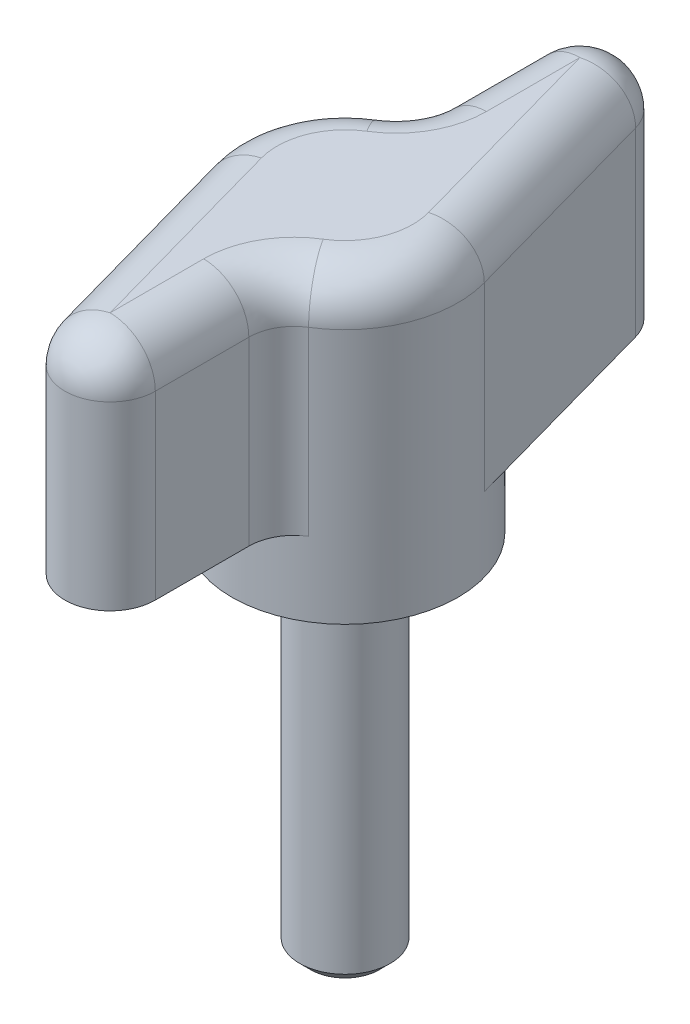
from build123d import *

# Parameters (mm, degrees)
SKETCH1_R         = 7.9375
EXTRUDE1_DEPTH    = 21.082
EXTRUDE2_START    = -15.875
EXTRUDE2_DEPTH    = 15.875
CIRPATTERN4_COUNT = 2
FILLET1_R         = 3.175
SKETCH7_R         = 3.175
EXTRUDE3_DEPTH    = 25.4
CHAMFER1_SIZE     = 0.762


with BuildPart() as part:
    # Sketch1 → Extrude1 (new body)
    with BuildSketch(Plane(origin=(0, 0, 0), x_dir=(1, 0, 0), z_dir=(0, 1, 0))):
        Circle(SKETCH1_R)
    extrude(amount=EXTRUDE1_DEPTH)

    # Sketch2 → Extrude2 (add)
    with BuildSketch(Plane(origin=(0, 21.082, 0), x_dir=(-1, 0, 0), z_dir=(0, 1, 0)).offset(EXTRUDE2_START)):
        with BuildLine():
            Line((2.68951844, -16.002), (2.68951844, -7.467958008))
            ThreePointArc((2.68951844, -7.467958008), (-3.642086896, -7.052595926), (-7.64626831, -2.130372546))
            Line((-7.64626831, -2.130372546), (-3.543988884, -16.854149018))
            ThreePointArc((-3.543988884, -16.854149018), (-0.055444209, -19.147742023), (2.68951844, -16.002))
        make_face()
    extrude2 = extrude(amount=EXTRUDE2_DEPTH)

    # CirPattern4: Extrude2 ×2 about axis
    cirpattern4_axis = Axis((0, 17.907, 0), (0, -1, 0))
    for i in range(1, CIRPATTERN4_COUNT):
        add(extrude2.rotate(cirpattern4_axis, i * 360 / CIRPATTERN4_COUNT))

    # Fillet1
    fillet1_edges = [part.edges().sort_by_distance(p)[0] for p in [
        (-2.68951844, 21.082, -11.734979004),
        (0.055444209, 21.082, -19.147742023),
        (5.595128597, 21.082, -9.492260782),
        (6.494303614, 21.082, 4.563762353),
        (2.68951844, 21.082, 11.734979004),
        (-0.055444209, 21.082, 19.147742023),
        (-5.595128597, 21.082, 9.492260782),
        (-7.052595926, 21.082, -3.642086896),
        (2.68951844, 13.1445, 7.467958008),
        (-2.68951844, 13.1445, -7.467958008),
    ]]
    fillet(fillet1_edges, radius=FILLET1_R)


with BuildPart() as body_2:
    # Sketch7 → Extrude3 (new body)
    with BuildSketch(Plane.XZ):
        Circle(SKETCH7_R)
    extrude(amount=EXTRUDE3_DEPTH)

    # Chamfer1
    chamfer1_edges = [body_2.edges().sort_by_distance(p)[0] for p in [
        (-3.175, -25.4, 0),
    ]]
    chamfer(chamfer1_edges, length=CHAMFER1_SIZE)


solid = Compound([part.part, body_2.part])
